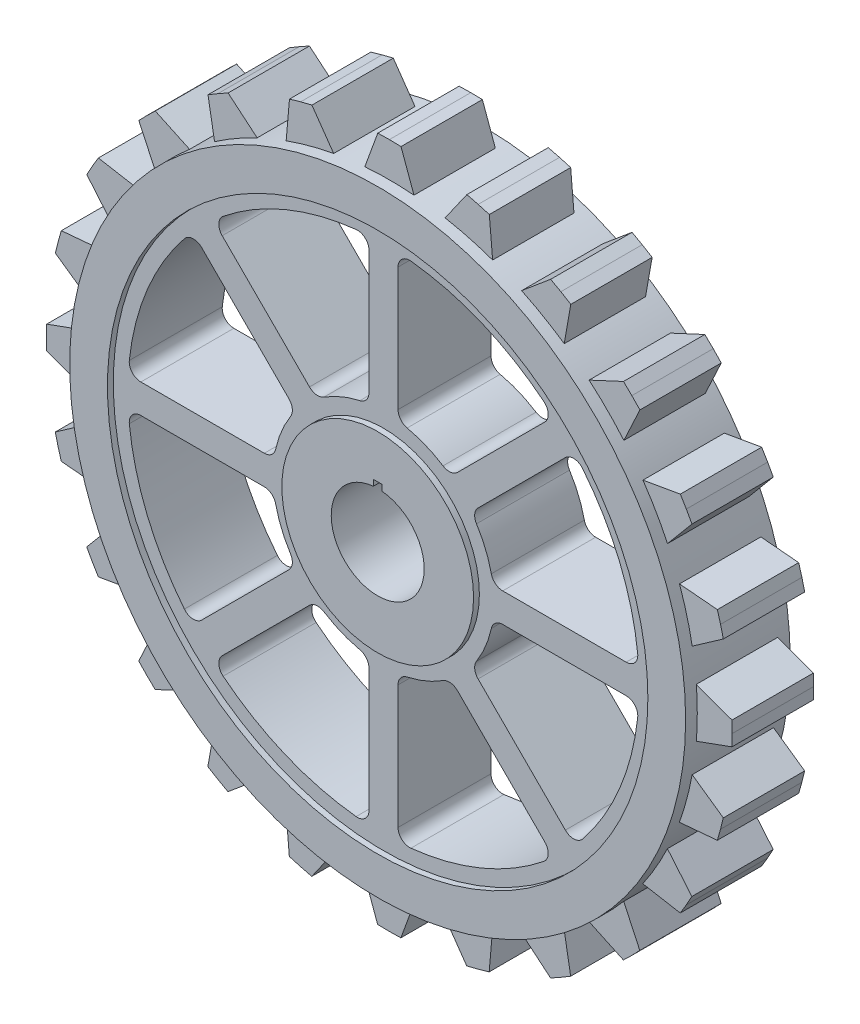
from build123d import *

# Parameters (mm, degrees)
BOSS_EXTRUDE4_DEPTH      = 9000
BOSS_EXTRUDE4_DEPTH_BACK = 9000
SKETCH1_R                = 53000
SKETCH1_R_2              = 46500
BOSS_EXTRUDE5_DEPTH      = 7000
BOSS_EXTRUDE5_DEPTH_BACK = 7000
BOSS_EXTRUDE6_DEPTH      = 8000
BOSS_EXTRUDE6_DEPTH_BACK = 8000
SKETCH3_R                = 46500
SKETCH3_R_2              = 16500
BOSS_EXTRUDE8_DEPTH      = 9000
BOSS_EXTRUDE8_DEPTH_BACK = 9000
SKETCH4_R                = 16500


with BuildPart() as part:
    # Sketch1 → Boss-Extrude4 (new, two sides: drawn at the far end of the back side and taken through both)
    with BuildSketch(Plane.XY.offset(-BOSS_EXTRUDE4_DEPTH_BACK)):
        with Locations((-5.964976959, 13.752585765)):
            Circle(SKETCH1_R)
        with Locations((-5.964976959, 13.752585765)):
            Circle(SKETCH1_R_2, mode=Mode.SUBTRACT)
    extrude(amount=BOSS_EXTRUDE4_DEPTH + BOSS_EXTRUDE4_DEPTH_BACK)

    # Sketch2 → Boss-Extrude5 (add, two sides: drawn at the far end of the back side and taken through both)
    with BuildSketch(Plane.XY.offset(-BOSS_EXTRUDE5_DEPTH_BACK)):
        Polygon((-52494.637998755, 4371.056522957), (-52496.669829396, -4346.58608228), (-58972.998826027, -1985.975704001), (-59005.964976959, 13.752585765), (-58972.066671874, 2013.465291359), align=None)
        Polygon((-49574.613909333, 17808.728463533), (-51832.868441655, 9388.658203244), (-57477.55095508, 13345.030020107), (-56991.826045237, 15285.151488458), (-56441.519063947, 17207.952108997), align=None)
        Polygon((-43276.161807912, 30032.764989636), (-47636.742727481, 22484.080947708), (-52065.10297269, 27766.59400205), (-51093.788351978, 29514.89257712), (-50064.575205833, 31229.745427892), align=None)
        Polygon((-34028.510796521, 40210.118213185), (-40194.251719868, 34047.250732286), (-43104.504264361, 40295.910489219), (-41713.79341901, 41733.242512317), (-40275.813283063, 43123.283205471), align=None)
        Polygon((-22461.873009121, 47647.218330869), (-30012.588881689, 43290.156645202), (-31206.404823978, 50079.127268689), (-29491.07239984, 51107.540937745), (-27742.321243983, 52078.040497193), align=None)
        Polygon((-9364.495696149, 51837.239260055), (-17785.617709371, 49582.909923113), (-17181.640465863, 56449.534284469), (-15258.583532921, 56998.944907469), (-13318.235858478, 57483.765392062), align=None)
        Polygon((4371.056522955, 52494.637998757), (-4346.586082281, 52496.669829397), (-1985.975704002, 58972.998826028), (13.752585764, 59005.96497696), (2013.465291358, 58972.066671875), align=None)
        Polygon((17808.728463532, 49574.613909335), (9388.658203242, 51832.868441657), (13345.030020106, 57477.550955083), (15285.151488457, 56991.826045239), (17207.952108996, 56441.519063949), align=None)
        Polygon((30032.764989635, 43276.161807914), (22484.080947707, 47636.742727483), (27766.594002049, 52065.102972692), (29514.892577119, 51093.788351981), (31229.745427891, 50064.575205835), align=None)
        Polygon((40210.118213184, 34028.510796523), (34047.250732285, 40194.251719871), (40295.910489218, 43104.504264363), (41733.242512316, 41713.793419012), (43123.28320547, 40275.813283066), align=None)
        Polygon((47647.218330868, 22461.873009123), (43290.1566452, 30012.588881691), (50079.127268688, 31206.40482398), (51107.540937743, 29491.072399842), (52078.040497191, 27742.321243985), align=None)
        Polygon((51837.239260054, 9364.49569615), (49582.909923112, 17785.617709372), (56449.534284468, 17181.640465865), (56998.944907468, 15258.583532923), (57483.76539206, 13318.235858479), align=None)
        Polygon((52494.637998756, -4371.056522954), (52496.669829396, 4346.586082283), (58972.998826027, 1985.975704004), (59005.964976959, -13.752585762), (58972.066671874, -2013.465291356), align=None)
        Polygon((49574.613909333, -17808.728463531), (51832.868441656, -9388.658203241), (57477.550955081, -13345.030020104), (56991.826045238, -15285.151488455), (56441.519063948, -17207.952108994), align=None)
        Polygon((43276.161807913, -30032.764989633), (47636.742727482, -22484.080947705), (52065.102972691, -27766.594002047), (51093.788351979, -29514.892577117), (50064.575205834, -31229.745427889), align=None)
        Polygon((34028.510796522, -40210.118213183), (40194.251719869, -34047.250732283), (43104.504264362, -40295.910489216), (41713.793419011, -41733.242512314), (40275.813283065, -43123.283205468), align=None)
        Polygon((22461.873009121, -47647.218330866), (30012.58888169, -43290.156645199), (31206.404823979, -50079.127268686), (29491.07239984, -51107.540937742), (27742.321243983, -52078.04049719), align=None)
        Polygon((9364.495696149, -51837.239260052), (17785.617709371, -49582.90992311), (17181.640465863, -56449.534284466), (15258.583532922, -56998.944907466), (13318.235858478, -57483.765392059), align=None)
        Polygon((-4371.056522955, -52494.637998754), (4346.586082282, -52496.669829394), (1985.975704003, -58972.998826025), (-13.752585764, -59005.964976957), (-2013.465291357, -58972.066671872), align=None)
        Polygon((-17808.728463532, -49574.613909332), (-9388.658203242, -51832.868441654), (-13345.030020105, -57477.55095508), (-15285.151488457, -56991.826045236), (-17207.952108995, -56441.519063946), align=None)
        Polygon((-30032.764989634, -43276.161807911), (-22484.080947706, -47636.74272748), (-27766.594002048, -52065.102972689), (-29514.892577118, -51093.788351978), (-31229.745427891, -50064.575205832), align=None)
        Polygon((-40210.118213184, -34028.51079652), (-34047.250732285, -40194.251719868), (-40295.910489218, -43104.50426436), (-41733.242512316, -41713.793419009), (-43123.28320547, -40275.813283063), align=None)
        Polygon((-47647.218330869, -22461.873009119), (-43290.156645201, -30012.588881688), (-50079.127268689, -31206.404823976), (-51107.540937744, -29491.072399838), (-52078.040497192, -27742.321243981), align=None)
        Polygon((-51837.239260054, -9364.495696147), (-49582.909923112, -17785.617709369), (-56449.534284468, -17181.640465861), (-56998.944907468, -15258.583532919), (-57483.765392061, -13318.235858475), align=None)
    extrude(amount=BOSS_EXTRUDE5_DEPTH + BOSS_EXTRUDE5_DEPTH_BACK)

    # Sketch3 → Boss-Extrude6 (add, two sides: drawn at the far end of the back side and taken through both)
    with BuildSketch(Plane.XY.offset(-BOSS_EXTRUDE6_DEPTH_BACK)):
        Circle(SKETCH3_R)
        Circle(SKETCH3_R_2, mode=Mode.SUBTRACT)
        with BuildLine():
            Line((2500, 20512.191496766), (2500, 41758.232721225))
            ThreePointArc((2500, 41758.232721225), (3163.693790438, 43246.280339511), (4714.285714286, 43746.719993664))
            ThreePointArc((4714.285714286, 43746.719993664), (16838.071024064, 40650.699430497), (27600.098965167, 34267.105759212))
            ThreePointArc((27600.098965167, 34267.105759212), (28342.668756346, 32816.807421979), (27759.762574578, 31295.296480511))
            Line((27759.762574578, 31295.296480511), (12736.542751394, 16272.076657327))
            ThreePointArc((12736.542751394, 16272.076657327), (11537.870258632, 15697.938629233), (10244.0121234, 16001.881627347))
            ThreePointArc((10244.0121234, 16001.881627347), (7270.985214937, 17553.711117714), (4071.428571429, 18558.649449455))
            ThreePointArc((4071.428571429, 18558.649449455), (2941.612555052, 19258.62515571), (2500, 20512.191496766))
        make_face(mode=Mode.SUBTRACT)
        with BuildLine():
            Line((16272.076657327, 12736.542751394), (31295.296480511, 27759.762574578))
            ThreePointArc((31295.296480511, 27759.762574578), (32816.807421979, 28342.668756346), (34267.105759212, 27600.098965167))
            ThreePointArc((34267.105759212, 27600.098965167), (40650.699430497, 16838.071024064), (43746.719993664, 4714.285714286))
            ThreePointArc((43746.719993664, 4714.285714286), (43246.280339511, 3163.693790438), (41758.232721225, 2500))
            Line((41758.232721225, 2500), (20512.191496766, 2500))
            ThreePointArc((20512.191496766, 2500), (19258.62515571, 2941.612555052), (18558.649449455, 4071.428571429))
            ThreePointArc((18558.649449455, 4071.428571429), (17553.711117714, 7270.985214937), (16001.881627347, 10244.0121234))
            ThreePointArc((16001.881627347, 10244.0121234), (15697.938629233, 11537.870258632), (16272.076657327, 12736.542751394))
        make_face(mode=Mode.SUBTRACT)
        with BuildLine():
            Line((20512.191496766, -2500), (41758.232721225, -2500))
            ThreePointArc((41758.232721225, -2500), (43246.280339511, -3163.693790438), (43746.719993664, -4714.285714286))
            ThreePointArc((43746.719993664, -4714.285714286), (40650.699430497, -16838.071024064), (34267.105759211, -27600.098965167))
            ThreePointArc((34267.105759211, -27600.098965167), (32816.807421979, -28342.668756346), (31295.296480511, -27759.762574578))
            Line((31295.296480511, -27759.762574578), (16272.076657327, -12736.542751394))
            ThreePointArc((16272.076657327, -12736.542751394), (15697.938629233, -11537.870258632), (16001.881627347, -10244.0121234))
            ThreePointArc((16001.881627347, -10244.0121234), (17553.711117714, -7270.985214937), (18558.649449455, -4071.428571429))
            ThreePointArc((18558.649449455, -4071.428571429), (19258.62515571, -2941.612555052), (20512.191496766, -2500))
        make_face(mode=Mode.SUBTRACT)
        with BuildLine():
            Line((12736.542751394, -16272.076657327), (27759.762574578, -31295.296480511))
            ThreePointArc((27759.762574578, -31295.296480511), (28342.668756346, -32816.807421979), (27600.098965167, -34267.105759212))
            ThreePointArc((27600.098965167, -34267.105759212), (16838.071024064, -40650.699430497), (4714.285714285, -43746.719993664))
            ThreePointArc((4714.285714285, -43746.719993664), (3163.693790438, -43246.280339511), (2500, -41758.232721225))
            Line((2500, -41758.232721225), (2500, -20512.191496766))
            ThreePointArc((2500, -20512.191496766), (2941.612555052, -19258.62515571), (4071.428571428, -18558.649449455))
            ThreePointArc((4071.428571428, -18558.649449455), (7270.985214937, -17553.711117714), (10244.0121234, -16001.881627347))
            ThreePointArc((10244.0121234, -16001.881627347), (11537.870258632, -15697.938629233), (12736.542751394, -16272.076657327))
        make_face(mode=Mode.SUBTRACT)
        with BuildLine():
            Line((-2500, -20512.191496766), (-2500, -41758.232721225))
            ThreePointArc((-2500, -41758.232721225), (-3163.693790438, -43246.280339511), (-4714.285714286, -43746.719993664))
            ThreePointArc((-4714.285714286, -43746.719993664), (-16838.071024064, -40650.699430496), (-27600.098965167, -34267.105759211))
            ThreePointArc((-27600.098965167, -34267.105759211), (-28342.668756346, -32816.807421979), (-27759.762574578, -31295.29648051))
            Line((-27759.762574578, -31295.29648051), (-12736.542751394, -16272.076657327))
            ThreePointArc((-12736.542751394, -16272.076657327), (-11537.870258632, -15697.938629233), (-10244.0121234, -16001.881627347))
            ThreePointArc((-10244.0121234, -16001.881627347), (-7270.985214937, -17553.711117714), (-4071.428571429, -18558.649449455))
            ThreePointArc((-4071.428571429, -18558.649449455), (-2941.612555052, -19258.62515571), (-2500, -20512.191496766))
        make_face(mode=Mode.SUBTRACT)
        with BuildLine():
            Line((-16272.076657327, -12736.542751394), (-31295.296480511, -27759.762574578))
            ThreePointArc((-31295.296480511, -27759.762574578), (-32816.807421979, -28342.668756346), (-34267.105759212, -27600.098965167))
            ThreePointArc((-34267.105759212, -27600.098965167), (-40650.699430497, -16838.071024064), (-43746.719993664, -4714.285714285))
            ThreePointArc((-43746.719993664, -4714.285714285), (-43246.280339511, -3163.693790437), (-41758.232721225, -2500))
            Line((-41758.232721225, -2500), (-20512.191496766, -2500))
            ThreePointArc((-20512.191496766, -2500), (-19258.62515571, -2941.612555052), (-18558.649449455, -4071.428571428))
            ThreePointArc((-18558.649449455, -4071.428571428), (-17553.711117715, -7270.985214937), (-16001.881627347, -10244.0121234))
            ThreePointArc((-16001.881627347, -10244.0121234), (-15697.938629233, -11537.870258631), (-16272.076657327, -12736.542751394))
        make_face(mode=Mode.SUBTRACT)
        with BuildLine():
            Line((-20512.191496766, 2500), (-41758.232721225, 2500))
            ThreePointArc((-41758.232721225, 2500), (-43246.280339511, 3163.693790438), (-43746.719993664, 4714.285714286))
            ThreePointArc((-43746.719993664, 4714.285714286), (-40650.699430496, 16838.071024064), (-34267.105759211, 27600.098965167))
            ThreePointArc((-34267.105759211, 27600.098965167), (-32816.807421979, 28342.668756347), (-31295.29648051, 27759.762574578))
            Line((-31295.29648051, 27759.762574578), (-16272.076657327, 12736.542751394))
            ThreePointArc((-16272.076657327, 12736.542751394), (-15697.938629233, 11537.870258632), (-16001.881627347, 10244.0121234))
            ThreePointArc((-16001.881627347, 10244.0121234), (-17553.711117714, 7270.985214937), (-18558.649449455, 4071.428571429))
            ThreePointArc((-18558.649449455, 4071.428571429), (-19258.62515571, 2941.612555052), (-20512.191496766, 2500))
        make_face(mode=Mode.SUBTRACT)
        with BuildLine():
            Line((-12736.542751394, 16272.076657327), (-27759.762574578, 31295.296480511))
            ThreePointArc((-27759.762574578, 31295.296480511), (-28342.668756346, 32816.807421979), (-27600.098965167, 34267.105759212))
            ThreePointArc((-27600.098965167, 34267.105759212), (-16838.071024063, 40650.699430497), (-4714.285714285, 43746.719993665))
            ThreePointArc((-4714.285714285, 43746.719993665), (-3163.693790437, 43246.280339511), (-2499.999999999, 41758.232721225))
            Line((-2499.999999999, 41758.232721225), (-2500, 20512.191496766))
            ThreePointArc((-2500, 20512.191496766), (-2941.612555052, 19258.62515571), (-4071.428571428, 18558.649449455))
            ThreePointArc((-4071.428571428, 18558.649449455), (-7270.985214936, 17553.711117715), (-10244.0121234, 16001.881627348))
            ThreePointArc((-10244.0121234, 16001.881627348), (-11537.870258631, 15697.938629233), (-12736.542751394, 16272.076657327))
        make_face(mode=Mode.SUBTRACT)
    extrude(amount=BOSS_EXTRUDE6_DEPTH + BOSS_EXTRUDE6_DEPTH_BACK)

    # Sketch4 → Boss-Extrude8 (add, two sides: drawn at the far end of the back side and taken through both)
    with BuildSketch(Plane.XY.offset(-BOSS_EXTRUDE8_DEPTH_BACK)):
        Circle(SKETCH4_R)
        with BuildLine():
            Line((-750, 9000), (750, 9000))
            Line((750, 9000), (750, 7964.766161037))
            ThreePointArc((750, 7964.766161037), (0, -8000), (-750, 7964.766161037))
            Line((-750, 7964.766161037), (-750, 9000))
        make_face(mode=Mode.SUBTRACT)
    extrude(amount=BOSS_EXTRUDE8_DEPTH + BOSS_EXTRUDE8_DEPTH_BACK)


solid = part.part
